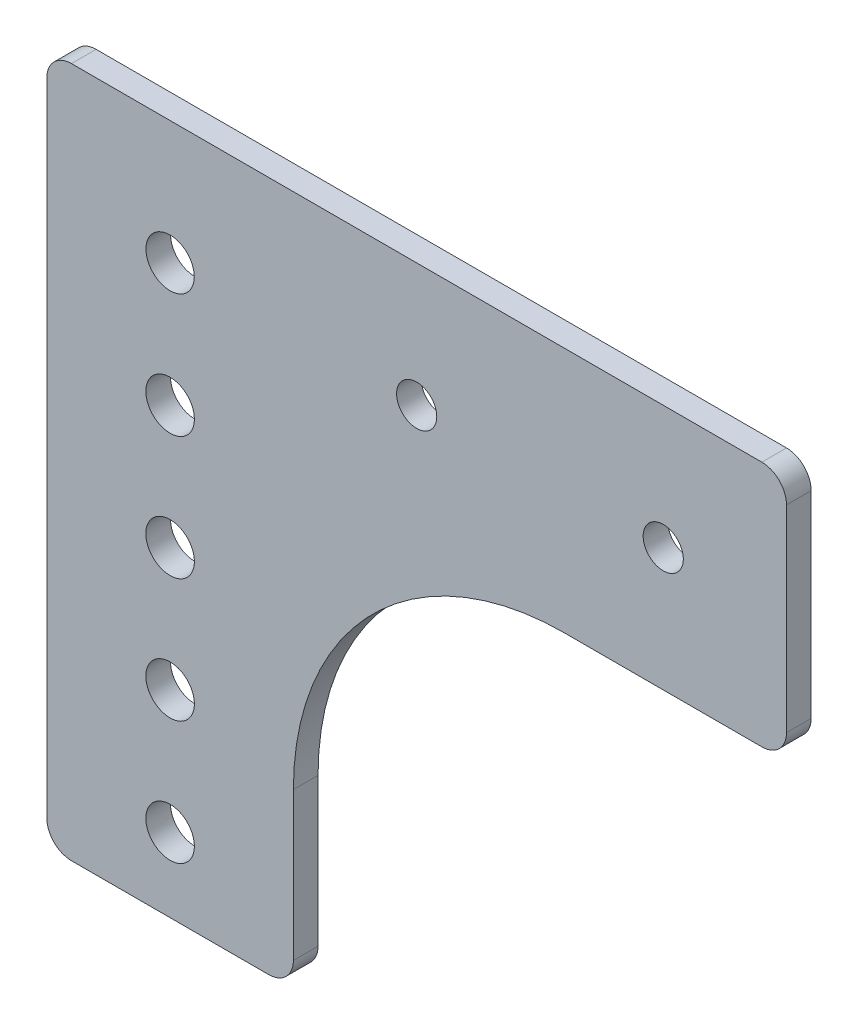
from build123d import *

# Parameters (mm, degrees)
SKETCH1_R           = 2.5
SKETCH1_R_2         = 2.4892
SKETCH1_R_3         = 2.0701
BOSS_EXTRUDE1_DEPTH = 2.54


with BuildPart() as part:
    # Sketch1 → Boss-Extrude1 (new body)
    with BuildSketch(Plane.XY):
        with BuildLine():
            Line((85.66, -50.8), (65.34, -50.8))
            ThreePointArc((65.34, -50.8), (45.583436534, -58.983436534), (37.4, -78.74))
            Line((37.4, -78.74), (37.4, -93.98))
            ThreePointArc((37.4, -93.98), (36.656051224, -95.776051224), (34.86, -96.52))
            Line((34.86, -96.52), (14.54, -96.52))
            ThreePointArc((14.54, -96.52), (12.743948776, -95.776051224), (12, -93.98))
            Line((12, -93.98), (12, -50.8))
            Line((12, -50.8), (12, -27.94))
            ThreePointArc((12, -27.94), (12.743948776, -26.143948776), (14.54, -25.4))
            Line((14.54, -25.4), (85.66, -25.4))
            ThreePointArc((85.66, -25.4), (87.456051224, -26.143948776), (88.2, -27.94))
            Line((88.2, -27.94), (88.2, -48.26))
            ThreePointArc((88.2, -48.26), (87.456051224, -50.056051224), (85.66, -50.8))
        make_face()
        with Locations((24.7, -88.9)):
            Circle(SKETCH1_R, mode=Mode.SUBTRACT)
        with Locations((24.7, -76.2)):
            Circle(SKETCH1_R, mode=Mode.SUBTRACT)
        with Locations((24.7, -63.5)):
            Circle(SKETCH1_R, mode=Mode.SUBTRACT)
        with Locations((24.7, -50.8)):
            Circle(SKETCH1_R, mode=Mode.SUBTRACT)
        with Locations((24.7, -38.1)):
            Circle(SKETCH1_R_2, mode=Mode.SUBTRACT)
        with Locations((50.1, -38.1)):
            Circle(SKETCH1_R_3, mode=Mode.SUBTRACT)
        with Locations((75.5, -38.1)):
            Circle(SKETCH1_R_3, mode=Mode.SUBTRACT)
    extrude(amount=BOSS_EXTRUDE1_DEPTH)


solid = part.part
